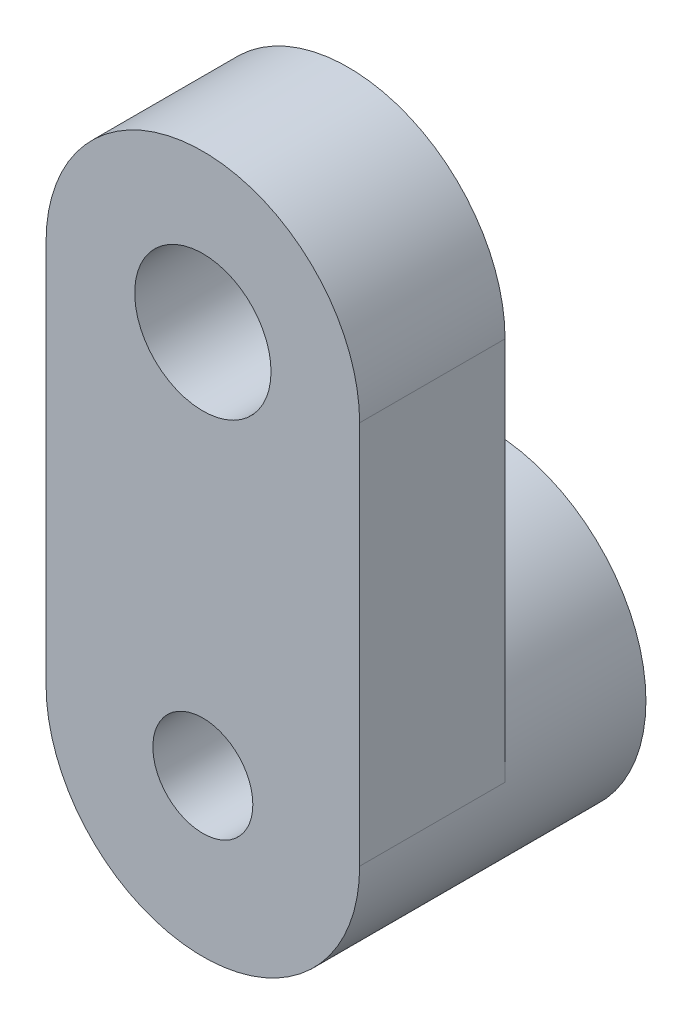
from build123d import *

# Parameters (mm, degrees)
SKETCH1_R           = 3.45
SKETCH1_R_2         = 2.525
BOSS_EXTRUDE1_DEPTH = 6.3
BOSS_EXTRUDE2_START = -3.2
SKETCH2_R           = 2.525
SKETCH2_R_2         = 1.1
BOSS_EXTRUDE2_DEPTH = 3.2
BOSS_EXTRUDE4_DEPTH = 3.1
CIRPATTERN3_COUNT   = 60
BOSS_EXTRUDE5_START = -3.2
BOSS_EXTRUDE5_DEPTH = 3.2
SKETCH5_R           = 1.5
CUT_EXTRUDE1_DEPTH  = 10


with BuildPart() as part:
    # Sketch1 → Boss-Extrude1 (new body)
    with BuildSketch(Plane.XY):
        Circle(SKETCH1_R)
        Circle(SKETCH1_R_2, mode=Mode.SUBTRACT)
    extrude(amount=BOSS_EXTRUDE1_DEPTH)

    # Sketch2 → Boss-Extrude2 (add)
    with BuildSketch(Plane.XY.offset(6.3).offset(BOSS_EXTRUDE2_START)):
        Circle(SKETCH2_R)
        Circle(SKETCH2_R_2, mode=Mode.SUBTRACT)
    extrude(amount=BOSS_EXTRUDE2_DEPTH)

    # Sketch3 → Boss-Extrude4 (add)
    with BuildSketch(Plane(origin=(0, 0, 0), x_dir=(-1, 0, 0), z_dir=(0, 0, -1))):
        with BuildLine():
            Line((-0.098093854, 2.523093854), (0, 2.425))
            Line((0, 2.425), (0, 2.525))
            ThreePointArc((0, 2.525), (-0.049056186, 2.524523419), (-0.098093854, 2.523093854))
        make_face()
        with BuildLine():
            Line((0, 2.525), (0, 2.425))
            Line((0, 2.425), (0.098093854, 2.523093854))
            ThreePointArc((0.098093854, 2.523093854), (0.049056186, 2.524523419), (0, 2.525))
        make_face()
    boss_extrude4 = extrude(amount=-BOSS_EXTRUDE4_DEPTH)

    # CirPattern3: Boss-Extrude4 ×60 about axis
    cirpattern3_axis = Axis((0, 0, 0), (0, 0, 1))
    for i in range(1, CIRPATTERN3_COUNT):
        add(boss_extrude4.rotate(cirpattern3_axis, i * 360 / CIRPATTERN3_COUNT))

    # Sketch4 → Boss-Extrude5 (add)
    with BuildSketch(Plane.XY.offset(6.3).offset(BOSS_EXTRUDE5_START)):
        with BuildLine():
            Line((-3.45, 8.45), (-3.45, 0))
            ThreePointArc((-3.45, 0), (0, 3.45), (3.45, 0))
            Line((3.45, 0), (3.45, 8.45))
            ThreePointArc((3.45, 8.45), (0, 11.9), (-3.45, 8.45))
        make_face()
    extrude(amount=BOSS_EXTRUDE5_DEPTH)

    # Sketch5 → Cut-Extrude1 (cut)
    with BuildSketch(Plane.XY.offset(6.3)):
        with Locations((0, 8.45)):
            Circle(SKETCH5_R)
    extrude(amount=-CUT_EXTRUDE1_DEPTH, mode=Mode.SUBTRACT)


solid = part.part
